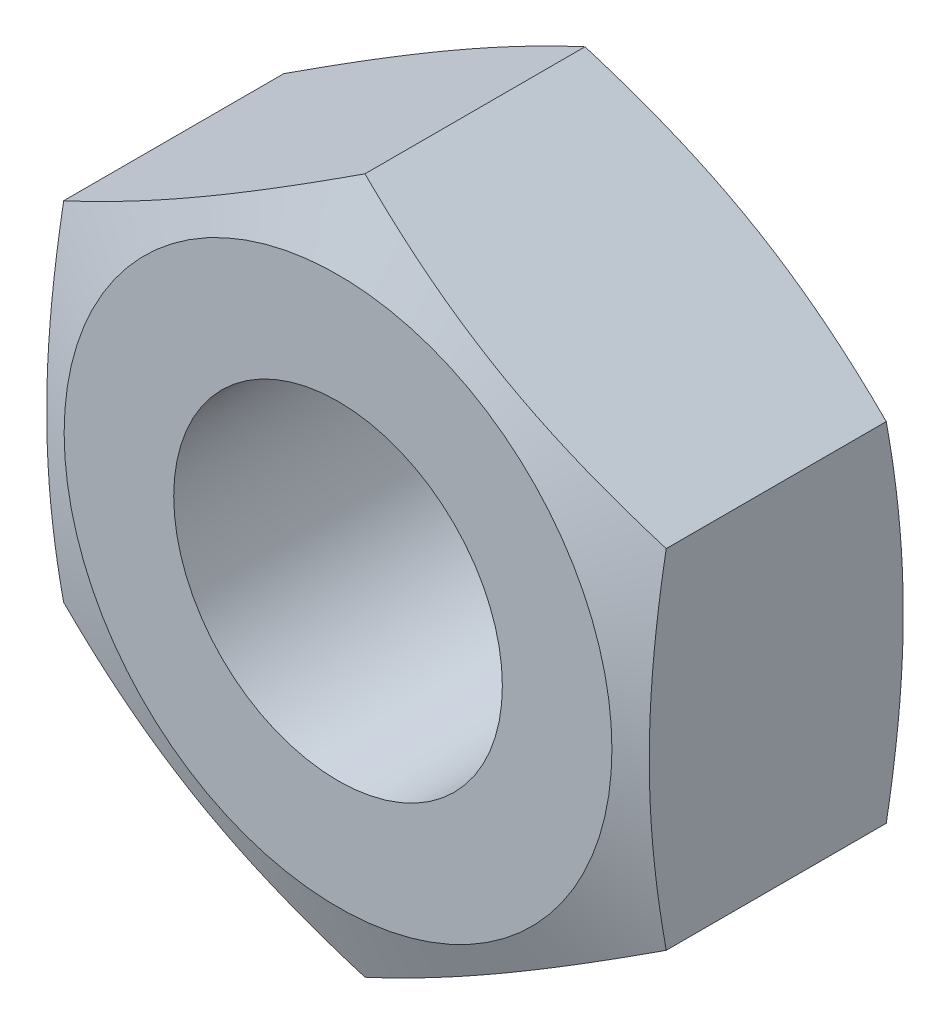
from build123d import *

# Parameters (mm, degrees)
SKETCH1_R               = 1.5
BOSS_EXTRUDE1_DEPTH     = 1.25
SKETCH2_OUTSIDE_W       = 22.99
SKETCH2_OUTSIDE_H       = 23.84
SKETCH2_OUTSIDE_R       = 2.5
CUT_EXTRUDE1_DEPTH      = 2.5
CUT_EXTRUDE1_DRAFT      = -70
MIRROR1_COPY_1_SKETCH_W = 22.99
MIRROR1_COPY_1_SKETCH_H = 23.84
MIRROR1_COPY_1_SKETCH_R = 2.5
MIRROR1_COPY_1_DEPTH    = 2.5
MIRROR1_COPY_1_DRAFT    = -70


with BuildPart() as part:
    # Sketch1 → Boss-Extrude1 (new, symmetric)
    with BuildSketch(Plane.XY):
        Polygon((0, 3.175426481), (-2.75, 1.58771324), (-2.75, -1.58771324), (0, -3.175426481), (2.75, -1.58771324), (2.75, 1.58771324), align=None)
        Circle(SKETCH1_R, mode=Mode.SUBTRACT)
    extrude(amount=BOSS_EXTRUDE1_DEPTH, both=True)


with BuildPart() as cut_extrude1_tool:
    # Sketch2 outside → Cut-Extrude1 (with draft: the straight prism first)
    with BuildSketch(Plane.XY.offset(1.25)):
        Rectangle(SKETCH2_OUTSIDE_W, SKETCH2_OUTSIDE_H)
        Circle(SKETCH2_OUTSIDE_R, mode=Mode.SUBTRACT)
    extrude(amount=-CUT_EXTRUDE1_DEPTH)
    # Cut-Extrude1: the draft: its side faces are tilted about the plane it starts from
    cut_extrude1_sides = [cut_extrude1_tool.faces().sort_by_distance(p)[0] for p in [
        (0, -11.92, 0),
        (11.495, 0, 0),
        (0, 11.92, 0),
        (-11.495, 0, 0),
        (-2.5, 0, 0),
    ]]
    draft(cut_extrude1_sides, Plane.XY.offset(1.25), CUT_EXTRUDE1_DRAFT)


with BuildPart() as part_1:
    add(part.part)

    # Cut-Extrude1: cut by cut_extrude1_tool
    add(cut_extrude1_tool.part, mode=Mode.SUBTRACT)


with BuildPart() as mirror1_copy_1_tool:
    # Mirror1 copy 1 sketch → Mirror1 copy 1 (with draft: the straight prism first)
    with BuildSketch(Plane(origin=(0, 0, -1.25), x_dir=(1, 0, 0), z_dir=(0, 0, -1))):
        Rectangle(MIRROR1_COPY_1_SKETCH_W, MIRROR1_COPY_1_SKETCH_H)
        Circle(MIRROR1_COPY_1_SKETCH_R, mode=Mode.SUBTRACT)
    extrude(amount=-MIRROR1_COPY_1_DEPTH)
    # Mirror1 copy 1: the draft: its side faces are tilted about the plane it starts from
    mirror1_copy_1_sides = [mirror1_copy_1_tool.faces().sort_by_distance(p)[0] for p in [
        (0, -11.92, 0),
        (11.495, 0, 0),
        (0, 11.92, 0),
        (-11.495, 0, 0),
        (-2.5, 0, 0),
    ]]
    draft(mirror1_copy_1_sides, Plane(origin=(0, 0, -1.25), x_dir=(1, 0, 0), z_dir=(0, 0, -1)), MIRROR1_COPY_1_DRAFT)


with BuildPart() as part_2:
    add(part_1.part)

    # Mirror1 copy 1: cut by mirror1_copy_1_tool
    add(mirror1_copy_1_tool.part, mode=Mode.SUBTRACT)


solid = part_2.part
